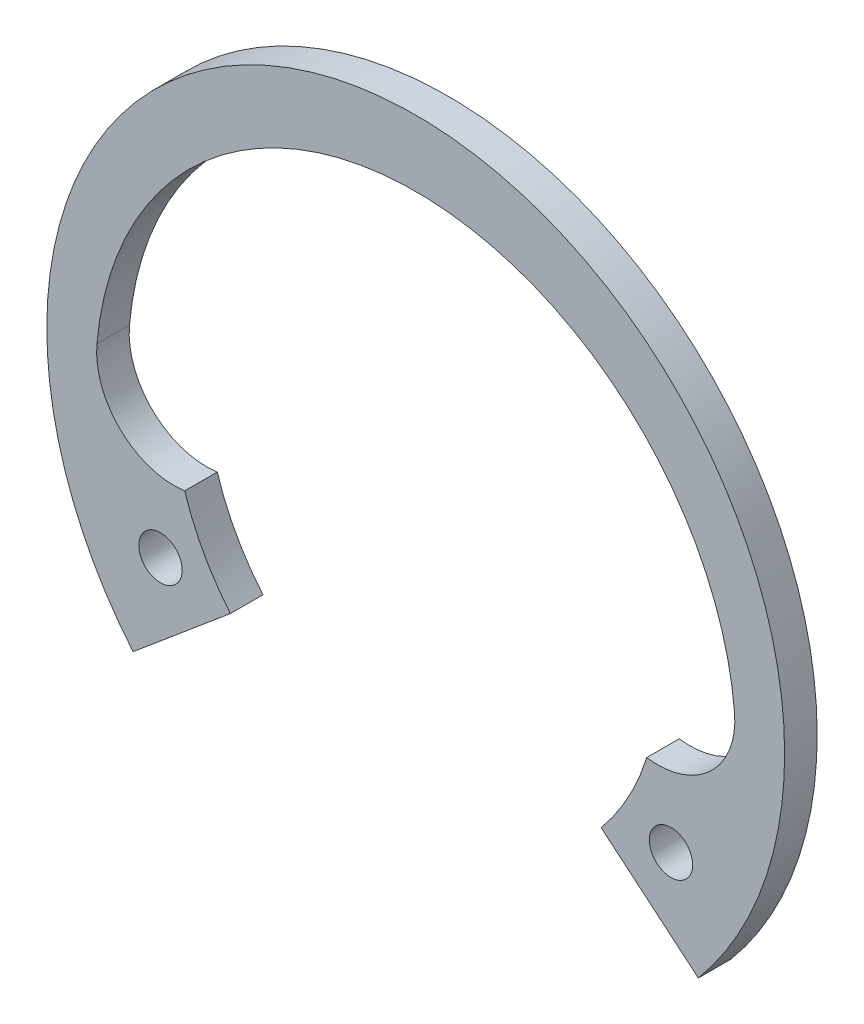
from build123d import *

# Parameters (mm, degrees)
SKETCH1_R           = 1
BOSS_EXTRUDE1_DEPTH = 1.5


with BuildPart() as part:
    # Sketch1 → Boss-Extrude1 (new body)
    with BuildSketch(Plane.XY):
        with BuildLine():
            Line((-13.022755533, -10.927389365), (-8.541395541, -7.167081848))
            ThreePointArc((-8.541395541, -7.167081848), (-9.783859128, -5.347765941), (-10.644354895, -3.319669993))
            ThreePointArc((-10.644354895, -3.319669993), (-13.596382147, -2.37892663), (-14.690850544, 0.51962506))
            ThreePointArc((-14.690850544, 0.51962506), (0, 13.95), (14.690850544, 0.51962506))
            ThreePointArc((14.690850544, 0.51962506), (13.596382147, -2.37892663), (10.644354895, -3.319669993))
            ThreePointArc((10.644354895, -3.319669993), (9.783859128, -5.347765941), (8.541395541, -7.167081848))
            Line((8.541395541, -7.167081848), (13.022755533, -10.927389365))
            ThreePointArc((13.022755533, -10.927389365), (0, 17), (-13.022755533, -10.927389365))
        make_face()
        with Locations((-11.762324169, -6.547389365)):
            Circle(SKETCH1_R, mode=Mode.SUBTRACT)
        with Locations(Location((11.762324169, -6.547389365, 0), (0, 0, 180))):
            Circle(SKETCH1_R, mode=Mode.SUBTRACT)
    extrude(amount=BOSS_EXTRUDE1_DEPTH)


solid = part.part
